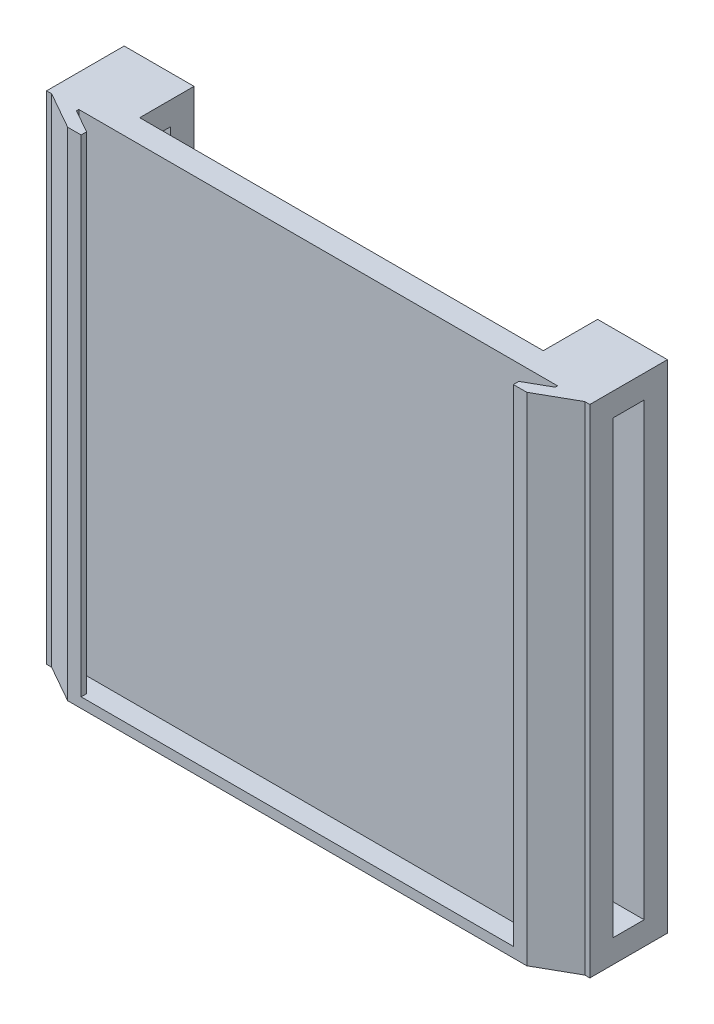
from build123d import *

# Parameters (mm, degrees)
SKETCH1_W           = 70
SKETCH1_H           = 64
BOSS_EXTRUDE1_DEPTH = 10
BOSS_EXTRUDE2_DEPTH = 64
BOSS_EXTRUDE3_DEPTH = 1.3
SKETCH5_W           = 52
SKETCH5_H           = 7
CUT_EXTRUDE1_DEPTH  = 75.042487803
SKETCH6_W           = 4
SKETCH6_H           = 58
CUT_EXTRUDE2_DEPTH  = 79.008268792


with BuildPart() as part:
    # Sketch1 → Boss-Extrude1 (new body)
    with BuildSketch(Plane.XY):
        Rectangle(SKETCH1_W, SKETCH1_H)
    extrude(amount=BOSS_EXTRUDE1_DEPTH)

    # Sketch2 → Boss-Extrude2 (add, through all)
    with BuildSketch(Plane(origin=(0, 32, 0), x_dir=(1, 0, 0), z_dir=(0, 1, 0))):
        Polygon((27.84617358, -12.7), (29.581467698, -12.7), (34.34617358, -10), (30.84617358, -10), (30.84617358, -10.3), (27.84617358, -12), align=None)
    boss_extrude2 = extrude(amount=-BOSS_EXTRUDE2_DEPTH)

    # Mirror1: Boss-Extrude2 across plane
    add(boss_extrude2.mirror(Plane.ZY))

    # Sketch3 → Boss-Extrude3 (add)
    with BuildSketch(Plane.XZ.offset(32)):
        Polygon((-27.84617358, 12), (-27.84617358, 12.7), (27.84617358, 12.7), (27.84617358, 12), (30.84617358, 10.3), (30.84617358, 10), (-30.84617358, 10), (-30.84617358, 10.3), align=None)
    extrude(amount=-BOSS_EXTRUDE3_DEPTH)

    # Sketch5 → Cut-Extrude1 (cut, through all)
    with BuildSketch(Plane(origin=(0, 32, 0), x_dir=(1, 0, 0), z_dir=(0, 1, 0))):
        with Locations((0, -3.5)):
            Rectangle(SKETCH5_W, SKETCH5_H)
    extrude(amount=-CUT_EXTRUDE1_DEPTH, mode=Mode.SUBTRACT)

    # Sketch6 → Cut-Extrude2 (cut, through all)
    with BuildSketch(Plane(origin=(35, 0, 0), x_dir=(0, 0, -1), z_dir=(1, 0, 0))):
        with Locations((-5, 0)):
            Rectangle(SKETCH6_W, SKETCH6_H)
    extrude(amount=-CUT_EXTRUDE2_DEPTH, mode=Mode.SUBTRACT)


solid = part.part
